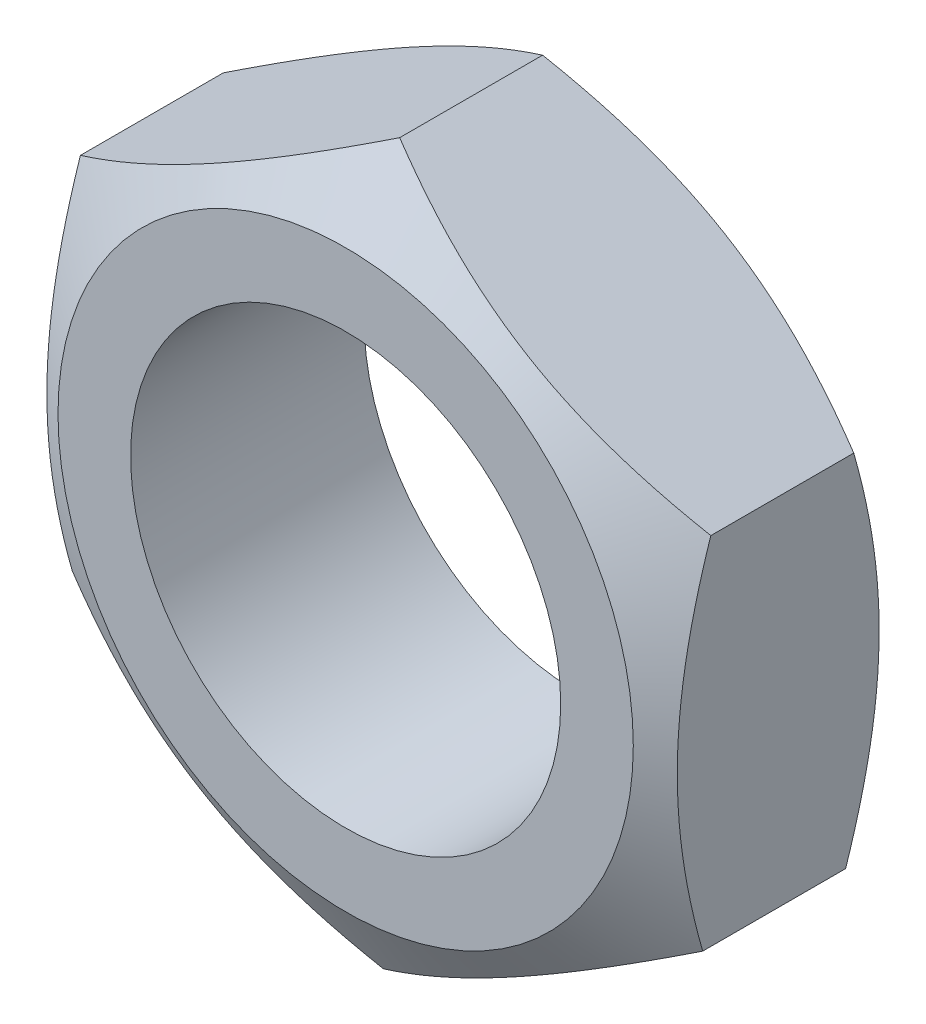
from build123d import *

# Parameters (mm, degrees)
CROQUIS1_R              = 9.208992718
SALIENTE_EXTRUIR1_DEPTH = 10
CROQUIS2_R              = 30.329695967
CROQUIS2_R_2            = 12.316965918
CORTAR_EXTRUIR1_DEPTH   = 10
CORTAR_EXTRUIR1_TAPER   = 59
CROQUIS3_R              = 29.014091156
CROQUIS3_R_2            = 12.401894161
CORTAR_EXTRUIR2_DEPTH   = 10
CORTAR_EXTRUIR2_DRAFT   = -59


with BuildPart() as part:
    # Croquis1 → Saliente-Extruir1 (new body)
    with BuildSketch(Plane.XY):
        Polygon((-13.322559753, 8.093787843), (-13.670705761, -7.490781268), (-0.348146008, -15.58456911), (13.322559753, -8.093787843), (13.670705761, 7.490781268), (0.348146008, 15.58456911), align=None)
        Circle(CROQUIS1_R, mode=Mode.SUBTRACT)
    extrude(amount=SALIENTE_EXTRUIR1_DEPTH)

    # Croquis2 → Cortar-Extruir1 (cut)
    with BuildSketch(Plane.XY.offset(10)):
        Circle(CROQUIS2_R)
        Circle(CROQUIS2_R_2, mode=Mode.SUBTRACT)
    extrude(amount=-CORTAR_EXTRUIR1_DEPTH, taper=CORTAR_EXTRUIR1_TAPER, mode=Mode.SUBTRACT)


with BuildPart() as cortar_extruir2_tool:
    # Croquis3 → Cortar-Extruir2 (with draft: the straight prism first)
    with BuildSketch(Plane(origin=(0, 0, 0), x_dir=(-1, 0, 0), z_dir=(0, 0, -1))):
        Circle(CROQUIS3_R)
        Circle(CROQUIS3_R_2, mode=Mode.SUBTRACT)
    extrude(amount=-CORTAR_EXTRUIR2_DEPTH)
    # Cortar-Extruir2: the draft: its side faces are tilted about the plane it starts from
    cortar_extruir2_sides = [cortar_extruir2_tool.faces().sort_by_distance(p)[0] for p in [
        (29.014091156, 0, 5),
        (12.401894161, 0, 5),
    ]]
    draft(cortar_extruir2_sides, Plane(origin=(0, 0, 0), x_dir=(-1, 0, 0), z_dir=(0, 0, -1)), CORTAR_EXTRUIR2_DRAFT)


with BuildPart() as part_1:
    add(part.part)

    # Cortar-Extruir2: cut by cortar_extruir2_tool
    add(cortar_extruir2_tool.part, mode=Mode.SUBTRACT)


solid = part_1.part
